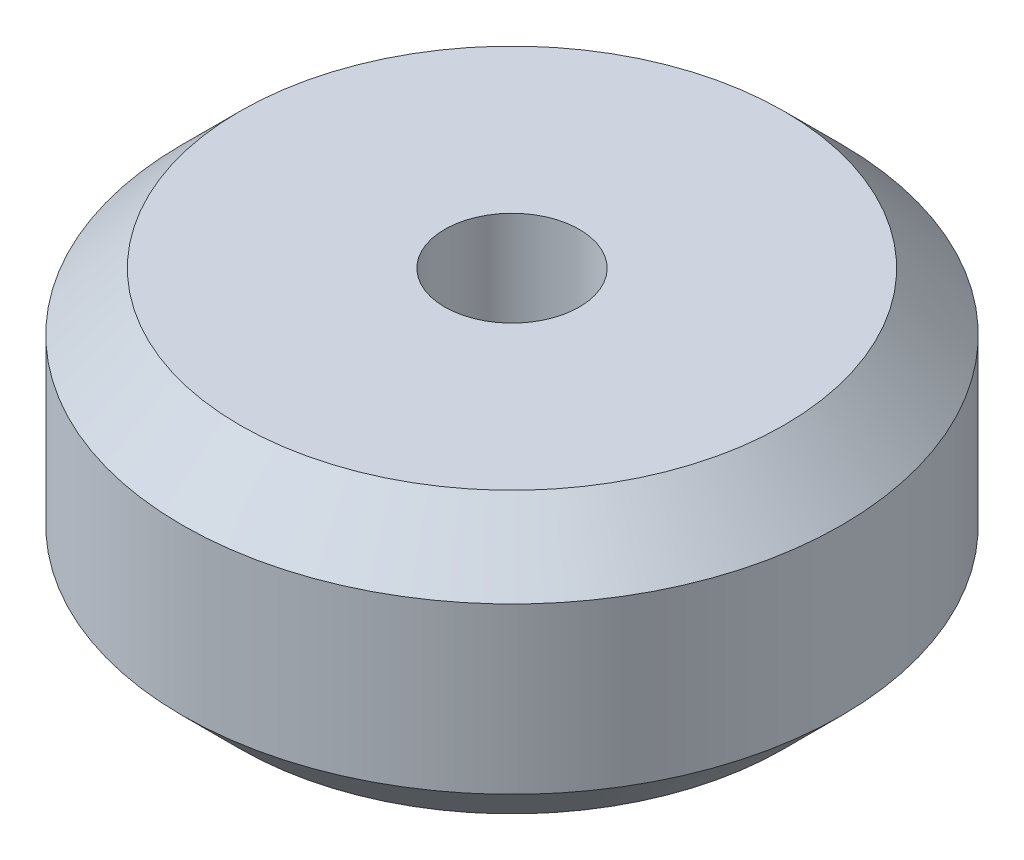
from build123d import *

# Parameters (mm, degrees)
SKETCH_1_R               = 12
EXTRUDE_1_DEPTH          = 5.1
CHAMFER_1_SIZE           = 2.1
CUT_EXTRUDE_1_DEPTH      = 18.720327311
CUT_EXTRUDE_1_DEPTH_BACK = 18.720327311
SKETCH_2_R               = 2.45


with BuildPart() as part:
    # 草图1 → 凸台-拉伸1 (new, symmetric)
    with BuildSketch(Plane(origin=(0, 0, 0), x_dir=(1, 0, 0), z_dir=(0, 1, 0))):
        with Locations(Location((0, 0, 0), (0, 0, 270))):
            Circle(SKETCH_1_R)
    extrude(amount=EXTRUDE_1_DEPTH, both=True)

    # 倒角1
    chamfer_1_edges = [part.edges().sort_by_distance(p)[0] for p in [
        (0, -5.1, -12),
        (0, 5.1, -12),
    ]]
    chamfer(chamfer_1_edges, length=CHAMFER_1_SIZE)

    # 草图2 → 切除-拉伸1 (cut, two sides: drawn at the far end of the back side and taken through both)
    with BuildSketch(Plane(origin=(0, 0, 0), x_dir=(1, 0, 0), z_dir=(0, 1, 0)).offset(-CUT_EXTRUDE_1_DEPTH_BACK)):
        with Locations(Location((0, 0, 0), (0, 0, 270))):
            Circle(SKETCH_2_R)
    extrude(amount=CUT_EXTRUDE_1_DEPTH + CUT_EXTRUDE_1_DEPTH_BACK, mode=Mode.SUBTRACT)


solid = part.part
